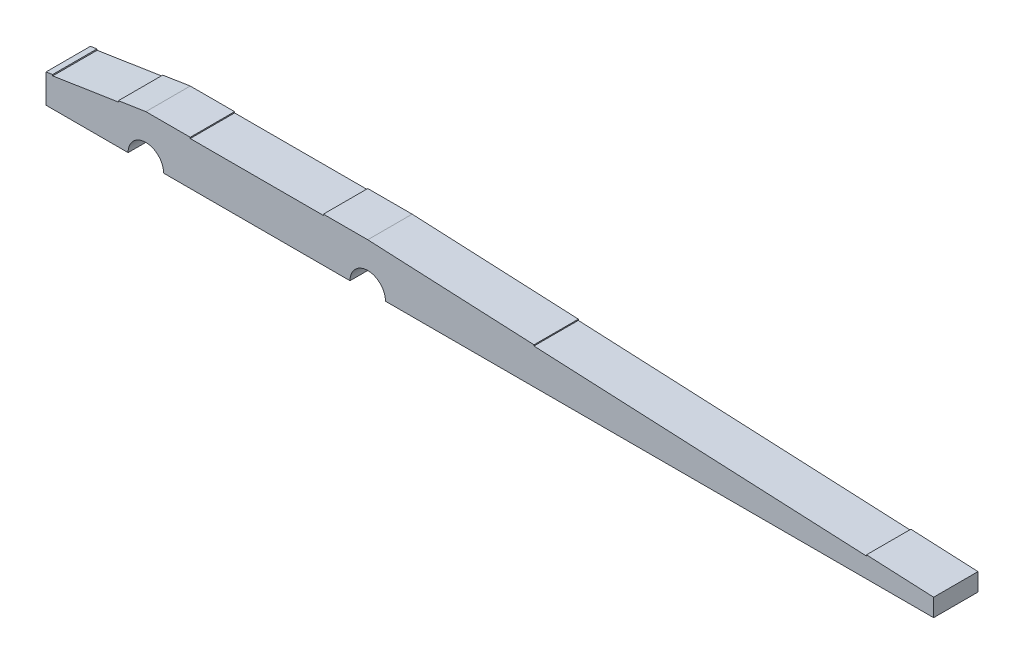
from build123d import *

# Parameters (mm, degrees)
BOSS_EXTRUDE1_DEPTH = 20
SKETCH2_W           = 150
SKETCH2_H           = 20
ROPEGROOVE1_DEPTH   = 0.5
SKETCH4_W           = 60
SKETCH4_H           = 20
ROPEGROOVE2_DEPTH   = 0.5
SKETCH5_W           = 30
SKETCH5_H           = 20
ROPEGROOVE3_DEPTH   = 0.5


with BuildPart() as part:
    # Sketch1 → Boss-Extrude1 (new body)
    with BuildSketch(Plane.XY):
        with BuildLine():
            Line((-8, 0), (-92, 0))
            ThreePointArc((-92, 0), (-100, 8), (-108, 0))
            Line((-108, 0), (-145, 0))
            Line((-145, 0), (-145, 13))
            Line((-145, 13), (-100, 20))
            Line((-100, 20), (0, 20))
            Line((0, 20), (255, 8))
            Line((255, 8), (255, 0))
            Line((255, 0), (8, 0))
            ThreePointArc((8, 0), (0, 8), (-8, 0))
        make_face()
    extrude(amount=BOSS_EXTRUDE1_DEPTH)

    # Sketch2 → RopeGroove1 (cut)
    with BuildSketch(Plane(origin=(0.93909681, 19.955807209, 0), x_dir=(0.9988945692351382, -0.047006803258124105, 0), z_dir=(0.047006803258124105, 0.9988945692351382, 0))):
        with Locations((149.059863935, -10)):
            Rectangle(SKETCH2_W, SKETCH2_H)
    extrude(amount=-ROPEGROOVE1_DEPTH, mode=Mode.SUBTRACT)

    # Sketch4 → RopeGroove2 (cut)
    with BuildSketch(Plane(origin=(0, 20, 0), x_dir=(1, 0, 0), z_dir=(0, 1, 0))):
        with Locations((-50, -10)):
            Rectangle(SKETCH4_W, SKETCH4_H)
    extrude(amount=-ROPEGROOVE2_DEPTH, mode=Mode.SUBTRACT)

    # Sketch5 → RopeGroove3 (cut)
    with BuildSketch(Plane(origin=(-5.400192864, 34.715525554, 0), x_dir=(0.9881164689548824, 0.15370700628187053, 0), z_dir=(-0.15370700628187053, 0.9881164689548824, 0))):
        with Locations((-123.278696917, -10)):
            Rectangle(SKETCH5_W, SKETCH5_H)
    extrude(amount=-ROPEGROOVE3_DEPTH, mode=Mode.SUBTRACT)


solid = part.part
